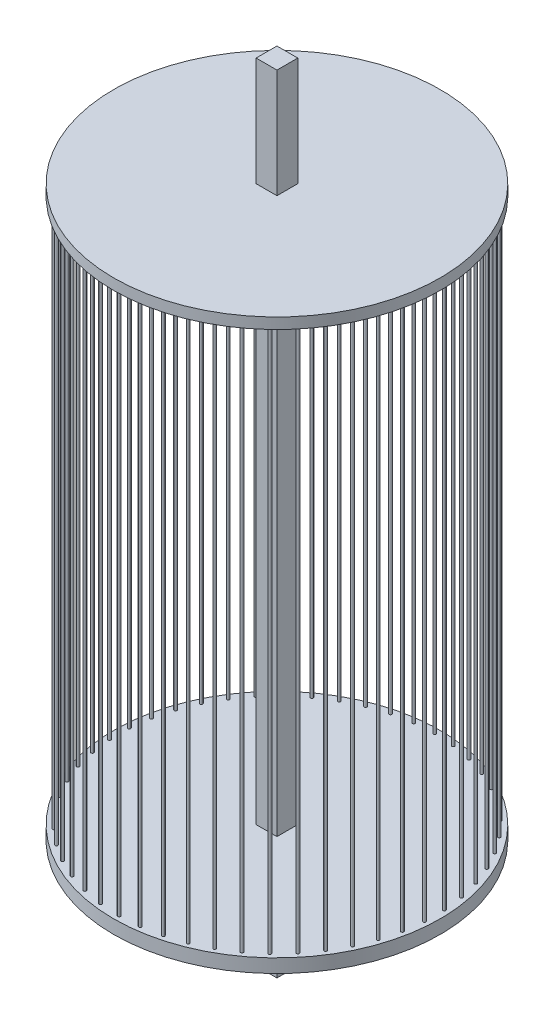
from build123d import *

# Parameters (mm, degrees)
SKETCH1_R           = 76.2
BOSS_EXTRUDE1_DEPTH = 6.35
SKETCH3_W           = 9.7234375
SKETCH3_H           = 9.7234375
BOSS_EXTRUDE2_DEPTH = 254
SKETCH4_R           = 76.2
BOSS_EXTRUDE3_DEPTH = 5.08
SKETCH5_R           = 0.635
BOSS_EXTRUDE4_DEPTH = 254
SKETCH6_W           = 9.7234375
SKETCH6_H           = 9.7234375
BOSS_EXTRUDE5_DEPTH = 50.8
SKETCH7_W           = 9.7234375
SKETCH7_H           = 9.7234375
BOSS_EXTRUDE6_DEPTH = 50.8


with BuildPart() as part:
    # Sketch1 → Boss-Extrude1 (new body)
    with BuildSketch(Plane(origin=(0, 0, 0), x_dir=(1, 0, 0), z_dir=(0, 1, 0))):
        with Locations(Location((0, 0, 0), (0, 0, 270))):
            Circle(SKETCH1_R)
    extrude(amount=BOSS_EXTRUDE1_DEPTH)

    # Sketch3 → Boss-Extrude2 (add)
    with BuildSketch(Plane(origin=(0, 6.35, 0), x_dir=(1, 0, 0), z_dir=(0, 1, 0))):
        Rectangle(SKETCH3_W, SKETCH3_H)
    extrude(amount=BOSS_EXTRUDE2_DEPTH)

    # Sketch4 → Boss-Extrude3 (add)
    with BuildSketch(Plane(origin=(0, 260.35, 0), x_dir=(1, 0, 0), z_dir=(0, 1, 0))):
        with Locations(Location((0, 0, 0), (0, 0, 270))):
            Circle(SKETCH4_R)
    extrude(amount=BOSS_EXTRUDE3_DEPTH)

    # Sketch5 → Boss-Extrude4 (add)
    with BuildSketch(Plane(origin=(0, 6.35, 0), x_dir=(1, 0, 0), z_dir=(0, 1, 0))):
        with Locations(Location((0, 73.66, 0), (0, 0, 270))):
            Circle(SKETCH5_R)
        with Locations(Location((9.232045984, 73.079168899, 0), (0, 0, 270))):
            Circle(SKETCH5_R)
        with Locations(Location((18.318497089, 71.345835649, 0), (0, 0, 270))):
            Circle(SKETCH5_R)
        with Locations(Location((27.116054551, 68.487335951, 0), (0, 0, 270))):
            Circle(SKETCH5_R)
        with Locations(Location((35.485975634, 64.548750052, 0), (0, 0, 270))):
            Circle(SKETCH5_R)
        with Locations(Location((43.296261684, 59.592191806, 0), (0, 0, 270))):
            Circle(SKETCH5_R)
        with Locations(Location((50.423739823, 53.695829096, 0), (0, 0, 270))):
            Circle(SKETCH5_R)
        with Locations(Location((56.756005463, 46.952651085, 0), (0, 0, 270))):
            Circle(SKETCH5_R)
        with Locations(Location((62.193194993, 39.469001718, 0), (0, 0, 270))):
            Circle(SKETCH5_R)
        with Locations(Location((66.649560685, 31.362902617, 0), (0, 0, 270))):
            Circle(SKETCH5_R)
        with Locations(Location((70.05482299, 22.762191806, 0), (0, 0, 270))):
            Circle(SKETCH5_R)
        with Locations(Location((72.355278889, 13.802507632, 0), (0, 0, 270))):
            Circle(SKETCH5_R)
        with Locations(Location((73.514648816, 4.625149669, 0), (0, 0, 270))):
            Circle(SKETCH5_R)
        with Locations(Location((73.514648816, -4.625149668, 0), (0, 0, 270))):
            Circle(SKETCH5_R)
        with Locations(Location((72.355278889, -13.802507632, 0), (0, 0, 270))):
            Circle(SKETCH5_R)
        with Locations(Location((70.05482299, -22.762191806, 0), (0, 0, 270))):
            Circle(SKETCH5_R)
        with Locations(Location((66.649560685, -31.362902617, 0), (0, 0, 270))):
            Circle(SKETCH5_R)
        with Locations(Location((62.193194993, -39.469001718, 0), (0, 0, 270))):
            Circle(SKETCH5_R)
        with Locations(Location((56.756005463, -46.952651085, 0), (0, 0, 270))):
            Circle(SKETCH5_R)
        with Locations(Location((50.423739823, -53.695829096, 0), (0, 0, 270))):
            Circle(SKETCH5_R)
        with Locations(Location((43.296261684, -59.592191806, 0), (0, 0, 270))):
            Circle(SKETCH5_R)
        with Locations(Location((35.485975635, -64.548750052, 0), (0, 0, 270))):
            Circle(SKETCH5_R)
        with Locations(Location((27.116054551, -68.48733595, 0), (0, 0, 270))):
            Circle(SKETCH5_R)
        with Locations(Location((18.318497089, -71.345835649, 0), (0, 0, 270))):
            Circle(SKETCH5_R)
        with Locations(Location((9.232045985, -73.079168899, 0), (0, 0, 270))):
            Circle(SKETCH5_R)
        with Locations(Location((0, -73.66, 0), (0, 0, 270))):
            Circle(SKETCH5_R)
        with Locations(Location((-9.232045984, -73.079168899, 0), (0, 0, 270))):
            Circle(SKETCH5_R)
        with Locations(Location((-18.318497088, -71.345835649, 0), (0, 0, 270))):
            Circle(SKETCH5_R)
        with Locations(Location((-27.116054551, -68.487335951, 0), (0, 0, 270))):
            Circle(SKETCH5_R)
        with Locations(Location((-35.485975634, -64.548750052, 0), (0, 0, 270))):
            Circle(SKETCH5_R)
        with Locations(Location((-43.296261684, -59.592191806, 0), (0, 0, 270))):
            Circle(SKETCH5_R)
        with Locations(Location((-50.423739823, -53.695829096, 0), (0, 0, 270))):
            Circle(SKETCH5_R)
        with Locations(Location((-56.756005463, -46.952651085, 0), (0, 0, 270))):
            Circle(SKETCH5_R)
        with Locations(Location((-62.193194992, -39.469001718, 0), (0, 0, 270))):
            Circle(SKETCH5_R)
        with Locations(Location((-66.649560684, -31.362902617, 0), (0, 0, 270))):
            Circle(SKETCH5_R)
        with Locations(Location((-70.05482299, -22.762191806, 0), (0, 0, 270))):
            Circle(SKETCH5_R)
        with Locations(Location((-72.355278889, -13.802507632, 0), (0, 0, 270))):
            Circle(SKETCH5_R)
        with Locations(Location((-73.514648816, -4.625149669, 0), (0, 0, 270))):
            Circle(SKETCH5_R)
        with Locations(Location((-73.514648816, 4.625149668, 0), (0, 0, 270))):
            Circle(SKETCH5_R)
        with Locations(Location((-72.355278889, 13.802507632, 0), (0, 0, 270))):
            Circle(SKETCH5_R)
        with Locations(Location((-70.05482299, 22.762191806, 0), (0, 0, 270))):
            Circle(SKETCH5_R)
        with Locations(Location((-66.649560685, 31.362902617, 0), (0, 0, 270))):
            Circle(SKETCH5_R)
        with Locations(Location((-62.193194992, 39.469001718, 0), (0, 0, 270))):
            Circle(SKETCH5_R)
        with Locations(Location((-56.756005463, 46.952651085, 0), (0, 0, 270))):
            Circle(SKETCH5_R)
        with Locations(Location((-50.423739823, 53.695829096, 0), (0, 0, 270))):
            Circle(SKETCH5_R)
        with Locations(Location((-43.296261684, 59.592191806, 0), (0, 0, 270))):
            Circle(SKETCH5_R)
        with Locations(Location((-35.485975634, 64.548750052, 0), (0, 0, 270))):
            Circle(SKETCH5_R)
        with Locations(Location((-27.116054551, 68.48733595, 0), (0, 0, 270))):
            Circle(SKETCH5_R)
        with Locations(Location((-18.318497089, 71.345835649, 0), (0, 0, 270))):
            Circle(SKETCH5_R)
        with Locations(Location((-9.232045984, 73.079168899, 0), (0, 0, 270))):
            Circle(SKETCH5_R)
    extrude(amount=BOSS_EXTRUDE4_DEPTH)

    # Sketch6 → Boss-Extrude5 (add)
    with BuildSketch(Plane(origin=(0, 265.43, 0), x_dir=(1, 0, 0), z_dir=(0, 1, 0))):
        Rectangle(SKETCH6_W, SKETCH6_H)
    extrude(amount=BOSS_EXTRUDE5_DEPTH)

    # Sketch7 → Boss-Extrude6 (add)
    with BuildSketch(Plane.XZ):
        Rectangle(SKETCH7_W, SKETCH7_H)
    extrude(amount=BOSS_EXTRUDE6_DEPTH)


solid = part.part
